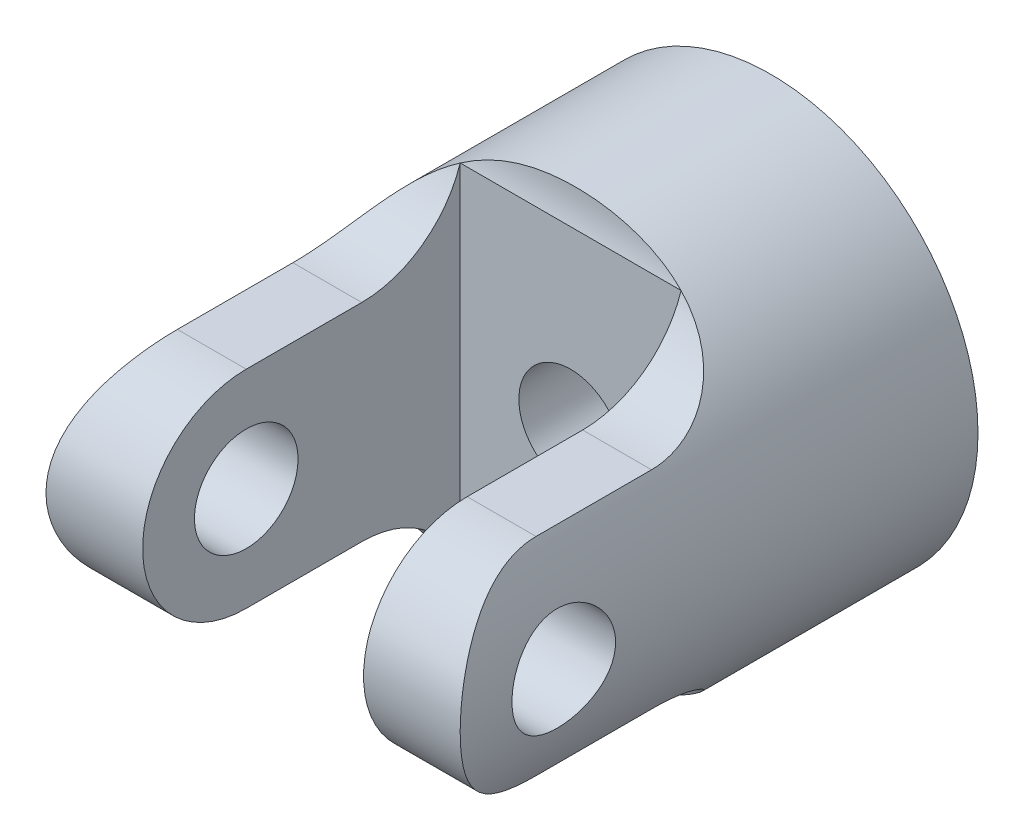
from build123d import *

# Parameters (mm, degrees)
SKETCH1_R               = 19.05
SKETCH1_R_2             = 4.765
BOSS_EXTRUDE1_DEPTH     = 47.63
CUT_EXTRUDE1_DEPTH      = 55.721311205
CUT_EXTRUDE1_DEPTH_BACK = 55.721311205
SKETCH2_W               = 20.32
SKETCH2_H               = 29.21
CUT_EXTRUDE3_DEPTH      = 55.721311205
CUT_EXTRUDE3_DEPTH_BACK = 55.721311205
CUT_EXTRUDE4_DEPTH      = 55.721311362
CUT_EXTRUDE4_DEPTH_BACK = 55.721311362
SKETCH3_5_R             = 4.765


with BuildPart() as part:
    # Sketch1 → Boss-Extrude1 (new body)
    with BuildSketch(Plane.XY):
        Circle(SKETCH1_R)
        Circle(SKETCH1_R_2, mode=Mode.SUBTRACT)
    extrude(amount=BOSS_EXTRUDE1_DEPTH)

    # Sketch2 → Cut-Extrude1 (cut, two sides: drawn at the far end of the back side and taken through both)
    with BuildSketch(Plane(origin=(0, 0, 0), x_dir=(1, 0, 0), z_dir=(0, 1, 0)).offset(-CUT_EXTRUDE1_DEPTH_BACK)):
        with Locations((0, -33.025)):
            Rectangle(SKETCH2_W, SKETCH2_H)
    extrude(amount=CUT_EXTRUDE1_DEPTH + CUT_EXTRUDE1_DEPTH_BACK, mode=Mode.SUBTRACT)

    # Sketch3 → Cut-Extrude3 (cut, two sides: drawn at the far end of the back side and taken through both)
    with BuildSketch(Plane(origin=(0, 0, 0), x_dir=(0, 0, -1), z_dir=(1, 0, 0)).offset(-CUT_EXTRUDE3_DEPTH_BACK)):
        with BuildLine():
            Line((-55.897546117, 9.53), (-47.63, 9.53))
            Line((-47.63, 9.53), (-47.63, 0))
            ThreePointArc((-47.63, 0), (-44.838727625, 6.738727625), (-38.1, 9.53))
            Line((-38.1, 9.53), (-27.476114037, 9.53))
            ThreePointArc((-27.476114037, 9.53), (-20.74445748, 12.318343443), (-17.956114037, 19.05))
            Line((-17.956114037, 19.05), (-47.497981878, 20.575601986))
            Line((-47.497981878, 20.575601986), (-55.897546117, 9.53))
        make_face()
        with BuildLine():
            ThreePointArc((-38.1, -9.53), (-44.838727625, -6.738727625), (-47.63, 0))
            Line((-47.63, 0), (-47.63, -9.53))
            Line((-47.63, -9.53), (-55.897546117, -9.53))
            Line((-55.897546117, -9.53), (-47.497981878, -20.575601986))
            Line((-47.497981878, -20.575601986), (-17.956114037, -19.05))
            ThreePointArc((-17.956114037, -19.05), (-20.74445748, -12.318343443), (-27.476114037, -9.53))
            Line((-27.476114037, -9.53), (-38.1, -9.53))
        make_face()
    extrude(amount=CUT_EXTRUDE3_DEPTH + CUT_EXTRUDE3_DEPTH_BACK, mode=Mode.SUBTRACT)

    # Sketch3<5> → Cut-Extrude4 (cut, two sides: drawn at the far end of the back side and taken through both)
    with BuildSketch(Plane(origin=(0, 0, 0), x_dir=(0, 0, -1), z_dir=(1, 0, 0)).offset(-CUT_EXTRUDE4_DEPTH_BACK)):
        with Locations((-38.1, 0)):
            Circle(SKETCH3_5_R)
    extrude(amount=CUT_EXTRUDE4_DEPTH + CUT_EXTRUDE4_DEPTH_BACK, mode=Mode.SUBTRACT)


solid = part.part
